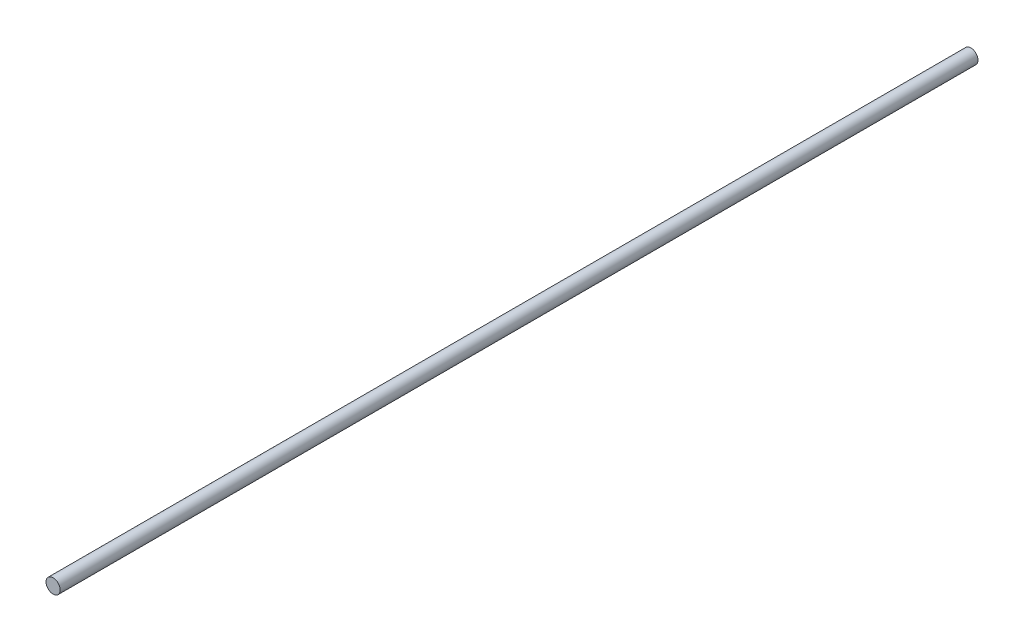
from build123d import *

# Parameters (mm, degrees)
SKETCH1_R           = 2.4
BOSS_EXTRUDE1_DEPTH = 310


with BuildPart() as part:
    # Sketch1 → Boss-Extrude1 (new body)
    with BuildSketch(Plane.XY):
        Circle(SKETCH1_R)
    extrude(amount=BOSS_EXTRUDE1_DEPTH)


solid = part.part
